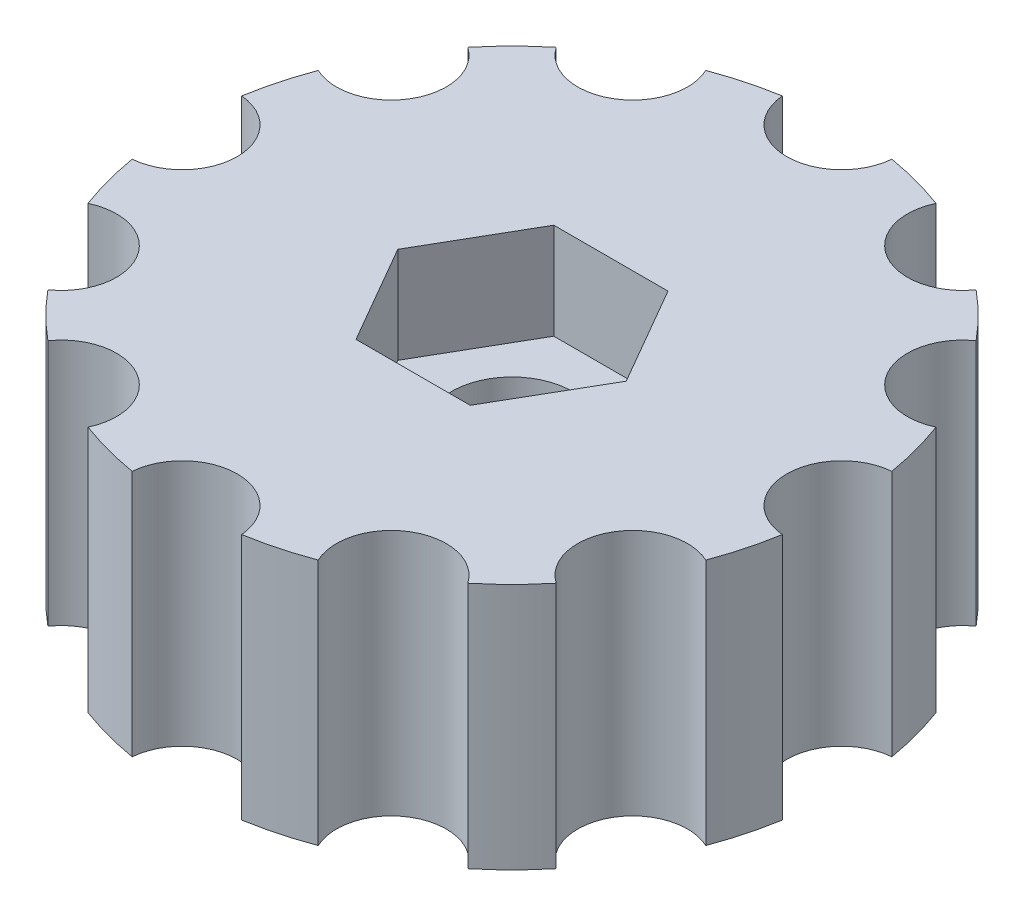
from build123d import *

# Parameters (mm, degrees)
CROQUIS_PERILLA_R    = 12
CUERPO_DEPTH         = 9
MOLETEADO_DEPTH      = 20.209372712
MOLETEADO_DEPTH_BACK = 20.209372712
CROQUIS_MOLETEADO_R  = 2
CROQUIS_ARANDELA_R   = 5.5
ARANDELA_DEPTH       = 2
PASO_M4_DEPTH        = 20.001461932
PASO_M4_DEPTH_BACK   = 20.001461932
CROQUIS_PASO_R       = 2.2
CABEZA_M4_DEPTH      = 3.5


with BuildPart() as part:
    # Croquis_perilla → Cuerpo (new body)
    with BuildSketch(Plane(origin=(0, 0, 0), x_dir=(1, 0, 0), z_dir=(0, 1, 0))):
        with Locations(Location((0, 0, 0), (0, 0, 270))):
            Circle(CROQUIS_PERILLA_R)
    extrude(amount=CUERPO_DEPTH)

    # Croquis_moleteado → Moleteado (cut, two sides: drawn at the far end of the back side and taken through both)
    with BuildSketch(Plane(origin=(0, 0, 0), x_dir=(1, 0, 0), z_dir=(0, 1, 0)).offset(-MOLETEADO_DEPTH_BACK)):
        with Locations((12, 0)):
            Circle(CROQUIS_MOLETEADO_R)
        with Locations((10.392304845, 6)):
            Circle(CROQUIS_MOLETEADO_R)
        with Locations((6, 10.392304845)):
            Circle(CROQUIS_MOLETEADO_R)
        with Locations((0, 12)):
            Circle(CROQUIS_MOLETEADO_R)
        with Locations((-6, 10.392304845)):
            Circle(CROQUIS_MOLETEADO_R)
        with Locations((-10.392304845, 6)):
            Circle(CROQUIS_MOLETEADO_R)
        with Locations((-12, 0)):
            Circle(CROQUIS_MOLETEADO_R)
        with Locations((-10.392304845, -6)):
            Circle(CROQUIS_MOLETEADO_R)
        with Locations((-6, -10.392304845)):
            Circle(CROQUIS_MOLETEADO_R)
        with Locations((0, -12)):
            Circle(CROQUIS_MOLETEADO_R)
        with Locations((6, -10.392304845)):
            Circle(CROQUIS_MOLETEADO_R)
        with Locations((10.392304845, -6)):
            Circle(CROQUIS_MOLETEADO_R)
    extrude(amount=MOLETEADO_DEPTH + MOLETEADO_DEPTH_BACK, mode=Mode.SUBTRACT)

    # Croquis_arandela → Arandela (add)
    with BuildSketch(Plane(origin=(0, 0, 0), x_dir=(1, 0, 0), z_dir=(0, 1, 0))):
        with Locations(Location((0, 0, 0), (0, 0, 270))):
            Circle(CROQUIS_ARANDELA_R)
    extrude(amount=-ARANDELA_DEPTH)

    # Croquis_paso → Paso_M4 (cut, two sides: drawn at the far end of the back side and taken through both)
    with BuildSketch(Plane(origin=(0, 0, 0), x_dir=(1, 0, 0), z_dir=(0, 1, 0)).offset(-PASO_M4_DEPTH_BACK)):
        with Locations(Location((0, 0, 0), (0, 0, 270))):
            Circle(CROQUIS_PASO_R)
    extrude(amount=PASO_M4_DEPTH + PASO_M4_DEPTH_BACK, mode=Mode.SUBTRACT)

    # Croquis_cabeza → Cabeza_M4 (cut)
    with BuildSketch(Plane(origin=(0, 9, 0), x_dir=(1, 0, 0), z_dir=(0, 1, 0))):
        Polygon((4.156921938, 0), (2.078460969, 3.6), (-2.078460969, 3.6), (-4.156921938, 0), (-2.078460969, -3.6), (2.078460969, -3.6), align=None)
    extrude(amount=-CABEZA_M4_DEPTH, mode=Mode.SUBTRACT)


solid = part.part
